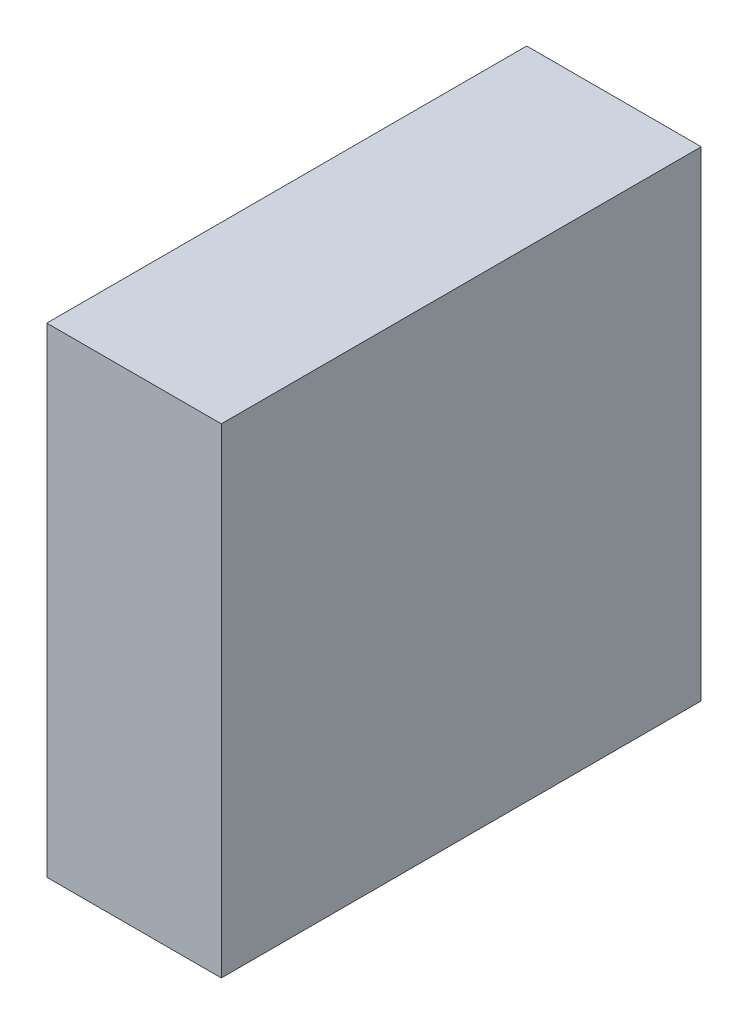
from build123d import *

# Parameters (mm, degrees)
SKETCH_1_W      = 110
SKETCH_1_H      = 110
EXTRUDE_2_DEPTH = 40


with BuildPart() as part:
    # 草图1 → 凸台-拉伸2 (new body)
    with BuildSketch(Plane(origin=(0, 0, 0), x_dir=(0, 0, -1), z_dir=(1, 0, 0))):
        with Locations((1.082247343, -1.799990478)):
            Rectangle(SKETCH_1_W, SKETCH_1_H)
    extrude(amount=EXTRUDE_2_DEPTH)


solid = part.part
